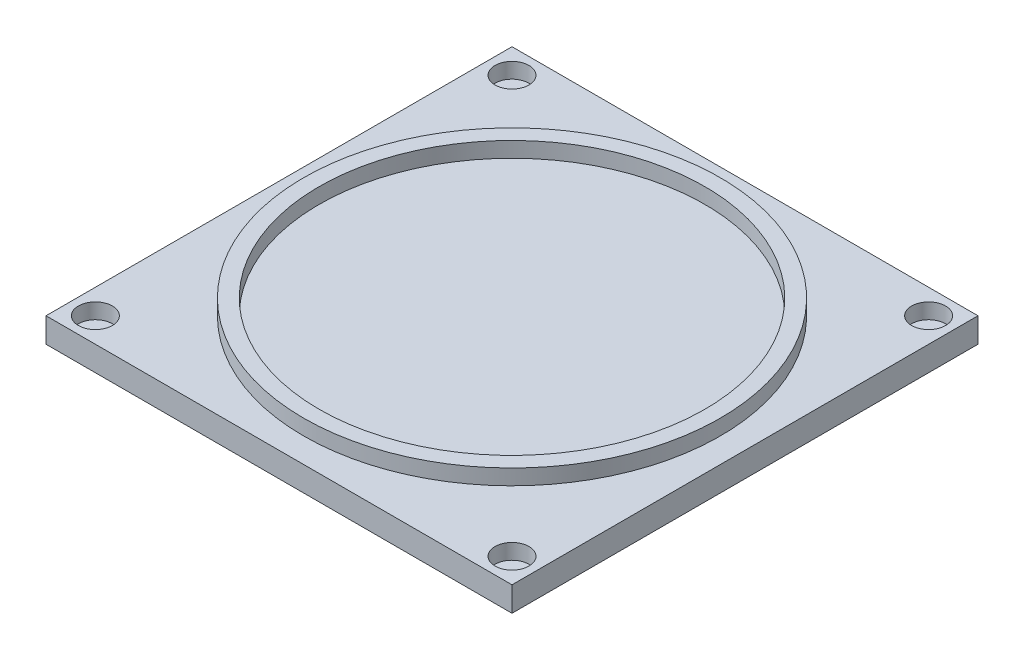
from build123d import *

# Parameters (mm, degrees)
SKETCH1_W           = 30.2
SKETCH1_H           = 30.2
BOSS_EXTRUDE1_DEPTH = 1.6
SKETCH2_R           = 13.5
SKETCH2_R_2         = 12.5
BOSS_EXTRUDE2_DEPTH = 1
SKETCH3_R           = 1.1
CUT_EXTRUDE1_DEPTH  = 1


with BuildPart() as part:
    # Sketch1 → Boss-Extrude1 (new body)
    with BuildSketch(Plane(origin=(0, 0, 0), x_dir=(1, 0, 0), z_dir=(0, 1, 0))):
        with Locations((-27.198924567, -19.439049917)):
            Rectangle(SKETCH1_W, SKETCH1_H)
    extrude(amount=BOSS_EXTRUDE1_DEPTH)

    # Sketch2 → Boss-Extrude2 (add)
    with BuildSketch(Plane(origin=(0, 1.6, 0), x_dir=(1, 0, 0), z_dir=(0, 1, 0))):
        with Locations(Location((-27.198924567, -19.439049917, 0), (0, 0, 270))):
            Circle(SKETCH2_R)
        with Locations(Location((-27.198924567, -19.439049917, 0), (0, 0, 270))):
            Circle(SKETCH2_R_2, mode=Mode.SUBTRACT)
    extrude(amount=BOSS_EXTRUDE2_DEPTH)

    # Sketch3 → Cut-Extrude1 (cut)
    with BuildSketch(Plane(origin=(0, 1.6, 0), x_dir=(1, 0, 0), z_dir=(0, 1, 0))):
        with Locations(Location((-40.698924567, -32.939049917, 0), (0, 0, 270))):
            Circle(SKETCH3_R)
        with Locations(Location((-13.698924567, -32.939049917, 0), (0, 0, 270))):
            Circle(SKETCH3_R)
        with Locations(Location((-13.698924567, -5.939049917, 0), (0, 0, 270))):
            Circle(SKETCH3_R)
        with Locations(Location((-40.698924567, -5.939049917, 0), (0, 0, 270))):
            Circle(SKETCH3_R)
    extrude(amount=-CUT_EXTRUDE1_DEPTH, mode=Mode.SUBTRACT)


solid = part.part
